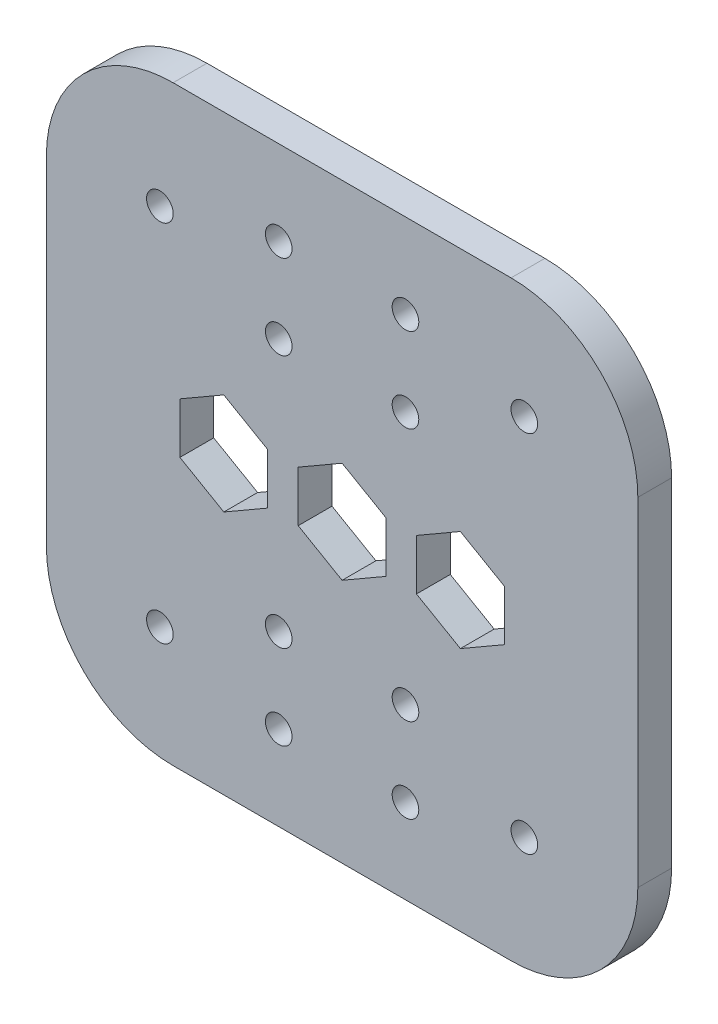
from build123d import *

# Parameters (mm, degrees)
SKETCH_1_W          = 70
SKETCH_1_H          = 70
EXTRUDE_1_DEPTH     = 4
SKETCH_2_R          = 1.575
CUT_EXTRUDE_1_DEPTH = 100.075728612
FILLET_1_R          = 15


with BuildPart() as part:
    # 草图1 → 凸台-拉伸1 (new body)
    with BuildSketch(Plane.XY):
        with Locations((35, -35)):
            Rectangle(SKETCH_1_W, SKETCH_1_H)
    extrude(amount=EXTRUDE_1_DEPTH)

    # 草图2 → 切除-拉伸1 (cut, through all)
    with BuildSketch(Plane.XY.offset(4)):
        with Locations((27.5, -10)):
            Circle(SKETCH_2_R)
        with Locations(Location((42.5, -10, 0), (0, 0, 180))):
            Circle(SKETCH_2_R)
        with Locations((42.5, -20)):
            Circle(SKETCH_2_R)
        with Locations(Location((27.5, -20, 0), (0, 0, 180))):
            Circle(SKETCH_2_R)
        with Locations((27.5, -50)):
            Circle(SKETCH_2_R)
        with Locations(Location((42.5, -50, 0), (0, 0, 180))):
            Circle(SKETCH_2_R)
        with Locations((42.5, -60)):
            Circle(SKETCH_2_R)
        with Locations(Location((27.5, -60, 0), (0, 0, 180))):
            Circle(SKETCH_2_R)
        with Locations((13.433243174, -13.433243174)):
            Circle(SKETCH_2_R)
        with Locations((56.566756826, -13.433243174)):
            Circle(SKETCH_2_R)
        with Locations((56.566756826, -56.566756826)):
            Circle(SKETCH_2_R)
        with Locations((13.433243174, -56.566756826)):
            Circle(SKETCH_2_R)
        Polygon((21, -29), (15.803847577, -32), (15.803847577, -38), (21, -41), (26.196152423, -38), (26.196152423, -32), align=None)
        Polygon((35, -41), (40.196152423, -38), (40.196152423, -32), (35, -29), (29.803847577, -32), (29.803847577, -38), align=None)
        Polygon((43.803847577, -38), (43.803847577, -32), (49, -29), (54.196152423, -32), (54.196152423, -38), (49, -41), align=None)
    extrude(amount=-CUT_EXTRUDE_1_DEPTH, mode=Mode.SUBTRACT)

    # 圆角1
    fillet_1_edges = [part.edges().sort_by_distance(p)[0] for p in [
        (0, 0, 2),
        (70, 0, 2),
        (70, -70, 2),
        (0, -70, 2),
    ]]
    fillet(fillet_1_edges, radius=FILLET_1_R)


solid = part.part
